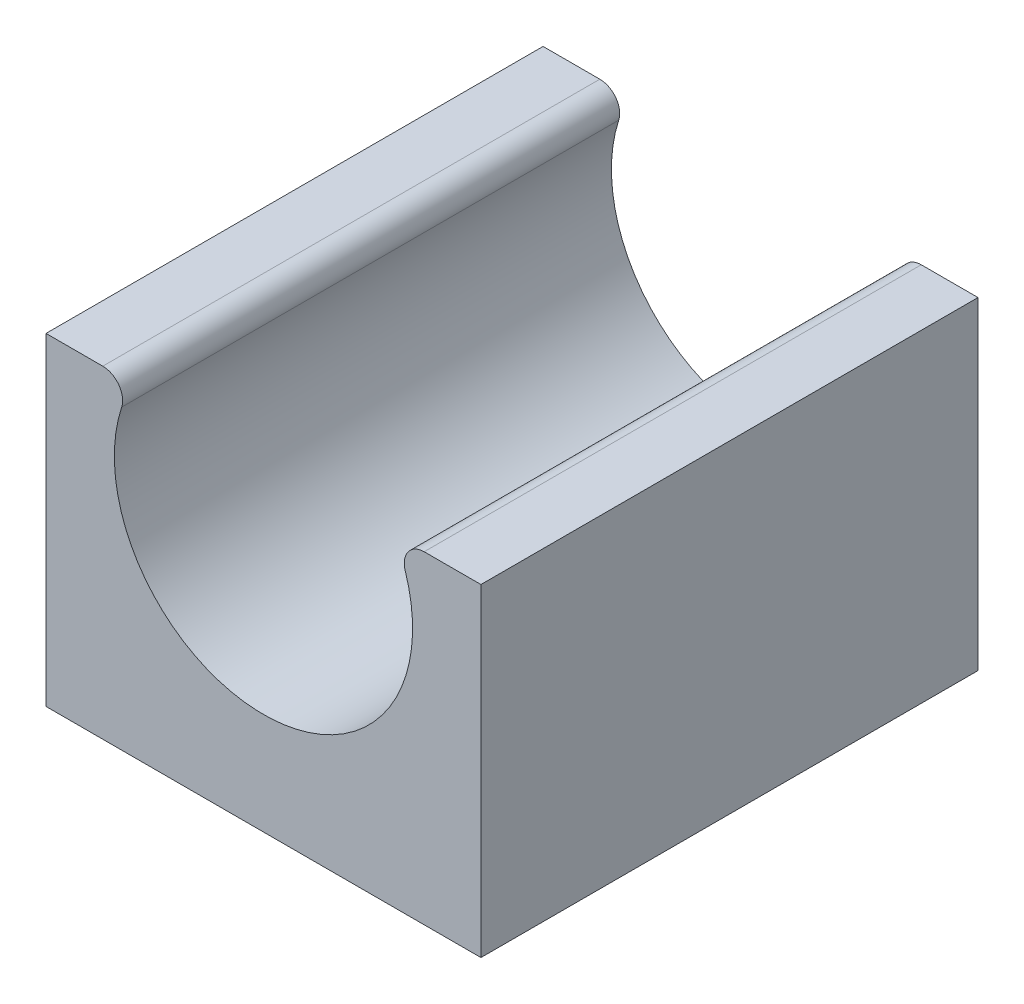
from build123d import *

# Parameters (mm, degrees)
BOSS_EXTRUDE1_DEPTH = 20
FILLET1_R           = 0.8


with BuildPart() as part:
    # Sketch1 → Boss-Extrude1 (new body)
    with BuildSketch(Plane.XY):
        with BuildLine():
            Line((-5.25, 6.5), (-8.75, 6.5))
            Line((-8.75, 6.5), (-8.75, -6.5))
            Line((-8.75, -6.5), (8.75, -6.5))
            Line((8.75, -6.5), (8.75, 6.5))
            Line((8.75, 6.5), (5.25, 6.5))
            ThreePointArc((5.25, 6.5), (0, -2.40473751), (-5.25, 6.5))
        make_face()
    extrude(amount=BOSS_EXTRUDE1_DEPTH)

    # Fillet1
    fillet1_edges = [part.edges().sort_by_distance(p)[0] for p in [
        (-5.25, 6.5, 10),
        (5.25, 6.5, 10),
    ]]
    fillet(fillet1_edges, radius=FILLET1_R)


solid = part.part
